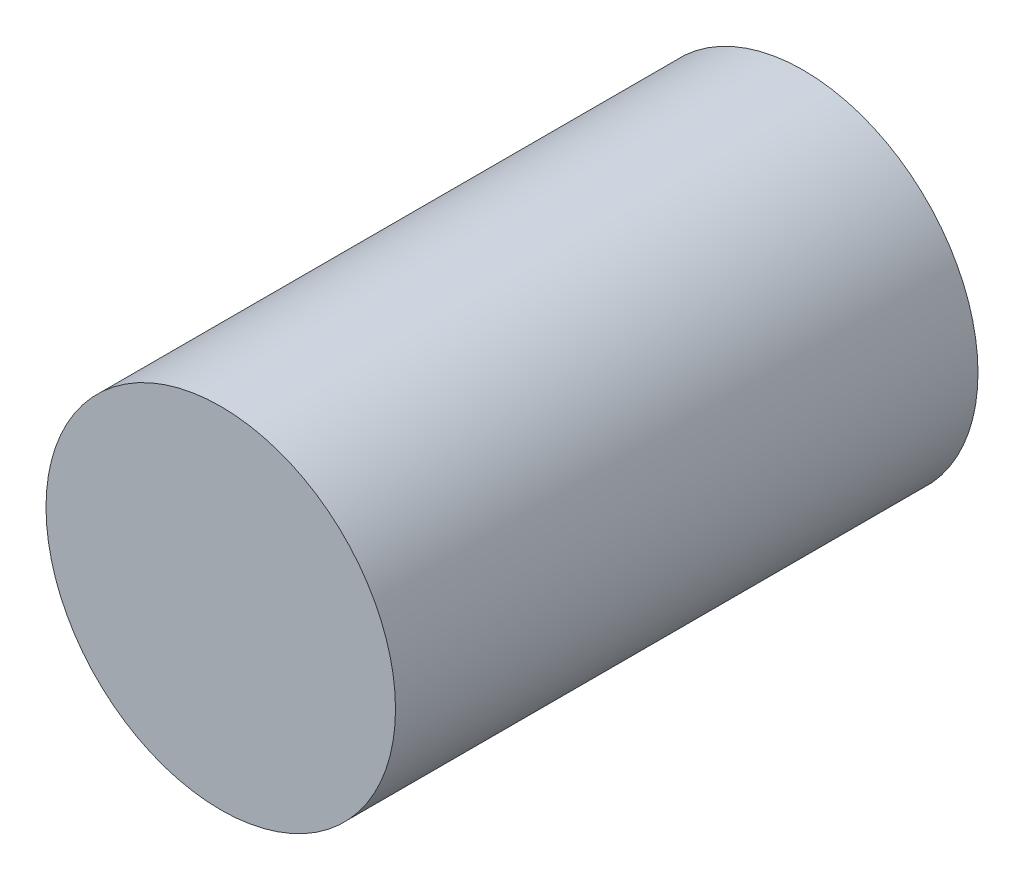
from build123d import *

# Parameters (mm, degrees)
SKETCH_1_R      = 150
EXTRUDE_1_DEPTH = 500


with BuildPart() as part:
    # ｽｹｯﾁ1 → ﾎﾞｽ - 押し出し1 (new body)
    with BuildSketch(Plane.XY):
        Circle(SKETCH_1_R)
    extrude(amount=EXTRUDE_1_DEPTH)


solid = part.part
